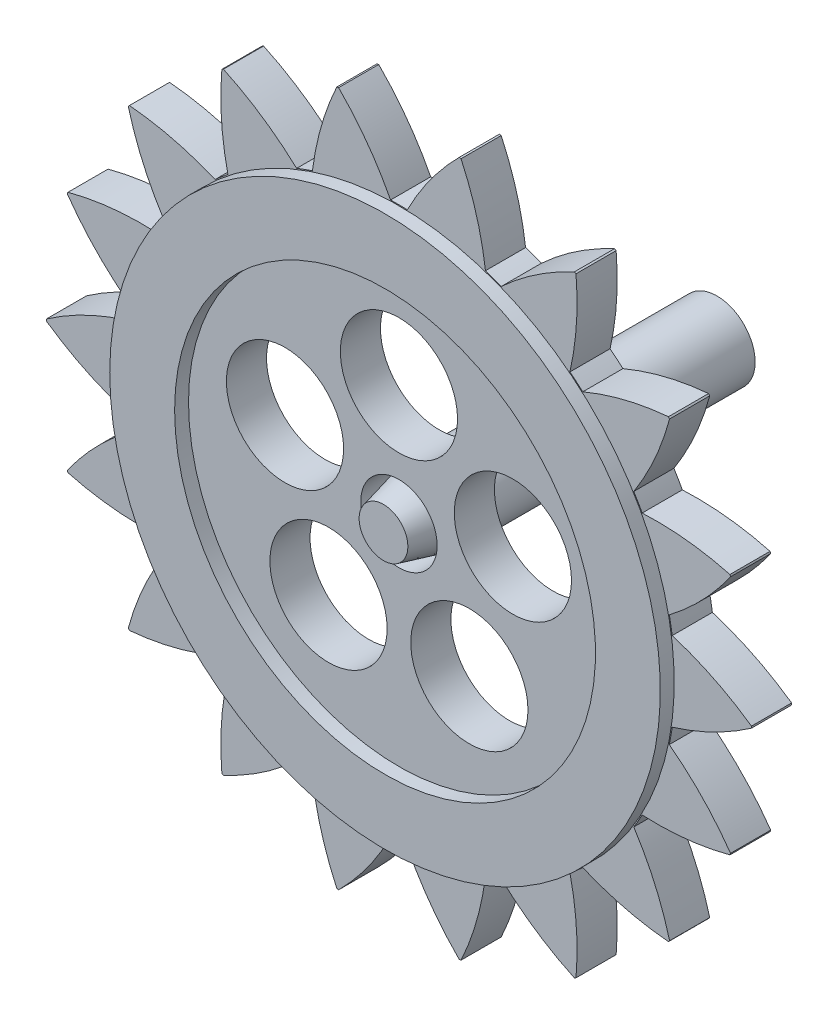
from build123d import *

# Parameters (mm, degrees)
ESQUISSE1_R                  = 2.284078073
ESQUISSE1_R_2                = 0.247571695
BOSS_EXTRU_1_DEPTH           = 0.26
ESQUISSE1_2_R                = 0.247571695
BOSS_EXTRU_2_DEPTH           = 0.36
BOSS_EXTRU_2_TAPER           = 14
BOSS_EXTRU_2_OTHER_WAY_DEPTH = 1.8
ENL_V_MAT_EXTRU_2_DEPTH      = 0.3
R_P_TITION_CIRCULAIRE2_COUNT = 18
ESQUISSE6_R                  = 1.783481367
ESQUISSE6_R_2                = 1.363245537
BOSS_EXTRU_4_DEPTH           = 0.09
ESQUISSE7_R                  = 0.379690264
ENL_V_MAT_EXTRU_3_DEPTH      = 0.29


with BuildPart() as part:
    # Esquisse1 → Boss.-Extru.1 (new body)
    with BuildSketch(Plane.XY):
        Circle(ESQUISSE1_R)
        Circle(ESQUISSE1_R_2, mode=Mode.SUBTRACT)
    extrude(amount=BOSS_EXTRU_1_DEPTH)



with BuildPart() as body_2:
    # Esquisse1<2> → Boss.-Extru.2 (new body)
    with BuildSketch(Plane.XY):
        Circle(ESQUISSE1_2_R)
    extrude(amount=BOSS_EXTRU_2_DEPTH, taper=BOSS_EXTRU_2_TAPER)


with BuildPart() as part_1:
    add(part.part)

    add(body_2.part)  # Boss.-Extru.2 other way merges body 2
    # Esquisse1<2> → Boss.-Extru.2 other way (add)
    with BuildSketch(Plane.XY):
        Circle(ESQUISSE1_2_R)
    extrude(amount=-BOSS_EXTRU_2_OTHER_WAY_DEPTH)

    # Esquisse5 → Enlèv. mat.-Extru.2 (cut)
    with BuildSketch(Plane.XY.offset(0.26)):
        with BuildLine():
            ThreePointArc((0.545916178, 2.389371867), (0, 2.450943164), (-0.545916178, 2.389371867))
            ThreePointArc((-0.545916178, 2.389371867), (-0.268336451, 2.114789396), (-0.054345927, 1.788210011))
            ThreePointArc((-0.054345927, 1.788210011), (0, 1.789035641), (0.054345927, 1.788210011))
            ThreePointArc((0.054345927, 1.788210011), (0.268336451, 2.114789396), (0.545916178, 2.389371867))
        make_face()
    enl_v_mat_extru_2 = extrude(amount=-ENL_V_MAT_EXTRU_2_DEPTH, mode=Mode.SUBTRACT)

    # Répétition circulaire2: Enlèv. mat.-Extru.2 ×18 about axis
    r_p_tition_circulaire2_axis = Axis((0, 0, 0), (0, 0, 1))
    for i in range(1, R_P_TITION_CIRCULAIRE2_COUNT):
        add(enl_v_mat_extru_2.rotate(r_p_tition_circulaire2_axis, i * 360 / R_P_TITION_CIRCULAIRE2_COUNT), mode=Mode.SUBTRACT)

    # Esquisse6 → Boss.-Extru.4 (add)
    with BuildSketch(Plane.XY.offset(0.26)):
        with Locations(Location((0, 0, 0), (0, 0, 180))):
            Circle(ESQUISSE6_R)
        with Locations(Location((0, 0, 0), (0, 0, 180))):
            Circle(ESQUISSE6_R_2, mode=Mode.SUBTRACT)
    extrude(amount=BOSS_EXTRU_4_DEPTH)

    # Esquisse7 → Enlèv. mat.-Extru.3 (cut)
    with BuildSketch(Plane.XY.offset(0.26)):
        with Locations((0, 0.776183942)):
            Circle(ESQUISSE7_R)
        with Locations((0.738194796, 0.239854029)):
            Circle(ESQUISSE7_R)
        with Locations((0.456229474, -0.627946)):
            Circle(ESQUISSE7_R)
        with Locations((-0.456229474, -0.627946)):
            Circle(ESQUISSE7_R)
        with Locations((-0.738194796, 0.239854029)):
            Circle(ESQUISSE7_R)
    extrude(amount=-ENL_V_MAT_EXTRU_3_DEPTH, mode=Mode.SUBTRACT)


solid = part_1.part
